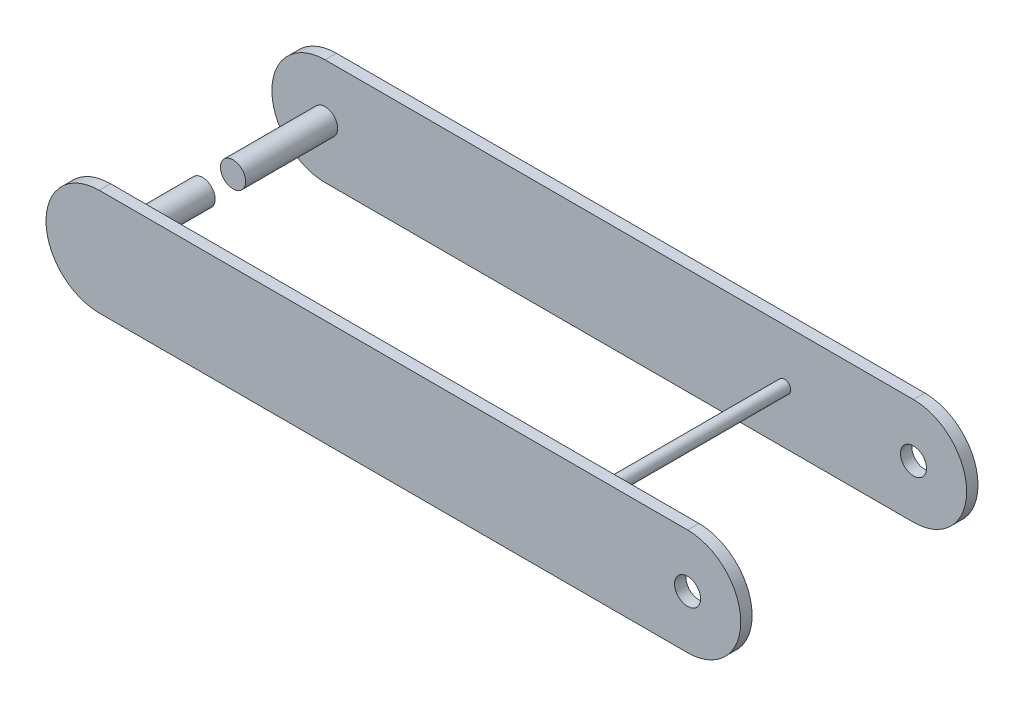
from build123d import *

# Parameters (mm, degrees)
SKETCH1_R           = 6.2
BOSS_EXTRUDE1_DEPTH = 5.4
SKETCH2_R           = 3
BOSS_EXTRUDE3_DEPTH = 102.1
BOSS_EXTRUDE4_START = 5.4
SKETCH4_R           = 6.2
BOSS_EXTRUDE4_DEPTH = 5.4
SKETCH5_R           = 6
BOSS_EXTRUDE5_DEPTH = 43.8


with BuildPart() as part:
    # Sketch1 → Boss-Extrude1 (new body)
    with BuildSketch(Plane.XY):
        with BuildLine():
            Line((0, 0), (-149.578947368, 0))
            ThreePointArc((-149.578947368, 0), (-174.878947368, -25.3), (-149.578947368, -50.6))
            Line((-149.578947368, -50.6), (130.421052632, -50.6))
            ThreePointArc((130.421052632, -50.6), (155.721052632, -25.3), (130.421052632, 0))
            Line((130.421052632, 0), (0, 0))
        make_face()
        with Locations(Location((130.421052632, -25.3, 0), (0, 0, 180))):
            Circle(SKETCH1_R, mode=Mode.SUBTRACT)
    extrude(amount=BOSS_EXTRUDE1_DEPTH)

    # Sketch2 → Boss-Extrude3 (add)
    with BuildSketch(Plane(origin=(0, 0, 0), x_dir=(-1, 0, 0), z_dir=(0, 0, -1))):
        with Locations(Location((-68.985809966, -25.3, 0), (0, 0, 180))):
            Circle(SKETCH2_R)
    extrude(amount=BOSS_EXTRUDE3_DEPTH)

    # Sketch4 → Boss-Extrude4 (add)
    with BuildSketch(Plane(origin=(0, 0, -102.1), x_dir=(-1, 0, 0), z_dir=(0, 0, -1)).offset(BOSS_EXTRUDE4_START)):
        with BuildLine():
            Line((-130.421052632, 0), (149.578947368, 0))
            ThreePointArc((149.578947368, 0), (174.878947368, -25.3), (149.578947368, -50.6))
            Line((149.578947368, -50.6), (-130.421052632, -50.6))
            ThreePointArc((-130.421052632, -50.6), (-155.721052632, -25.3), (-130.421052632, 0))
        make_face()
        with Locations((-130.421052632, -25.3)):
            Circle(SKETCH4_R, mode=Mode.SUBTRACT)
    extrude(amount=-BOSS_EXTRUDE4_DEPTH)

    # Sketch5 → Boss-Extrude5 (add)
    with BuildSketch(Plane.XY.offset(-102.1)):
        with Locations((-149.578947368, -25.3)):
            Circle(SKETCH5_R)
    boss_extrude5 = extrude(amount=BOSS_EXTRUDE5_DEPTH)

    # Mirror1: Boss-Extrude5 across plane
    add(boss_extrude5.mirror(Plane.XY.offset(-51.05)))


solid = part.part
